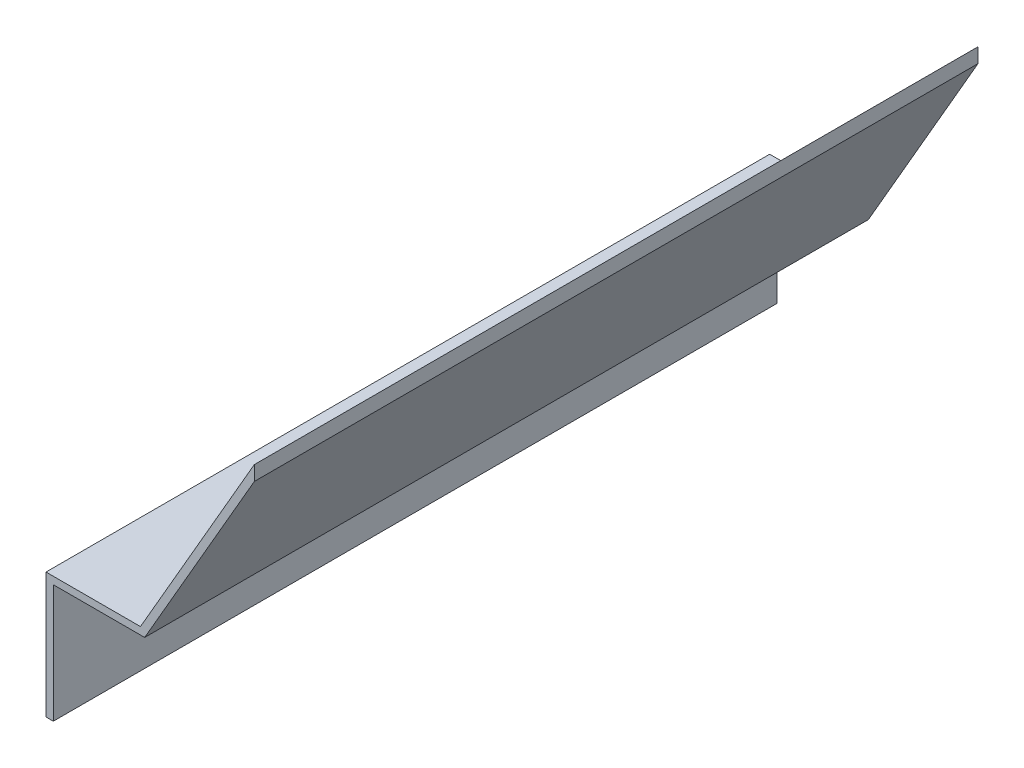
from build123d import *

# Parameters (mm, degrees)
BOSS_EXTRUDE1_DEPTH = 198


with BuildPart() as part:
    # Sketch1 → Boss-Extrude1 (new body)
    with BuildSketch(Plane.XY):
        Polygon((-106.888143666, 84.103851756), (-106.888143666, 116.459190816), (-81.888143666, 116.459190816), (-51.888143666, 168.420715043), (-51.888143666, 172.420715043), (-53.620194473, 169.420715043), (-83.042844204, 118.459190816), (-108.888143666, 118.459190816), (-108.888143666, 84.103851756), align=None)
    extrude(amount=BOSS_EXTRUDE1_DEPTH)


solid = part.part
